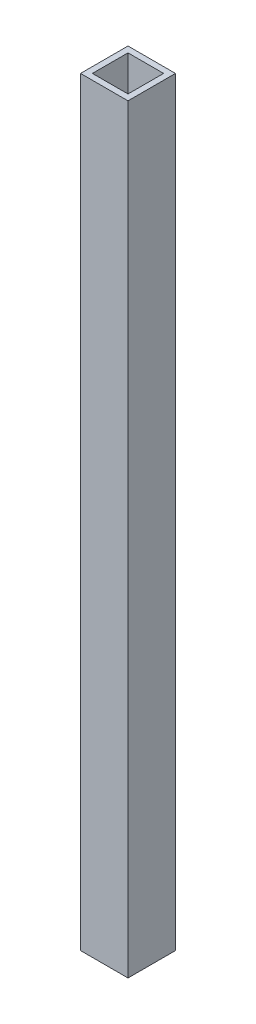
from build123d import *

# Parameters (mm, degrees)
SKETCH1_W           = 25.4
SKETCH1_H           = 406.4
BOSS_EXTRUDE1_DEPTH = 12.7
SKETCH2_W           = 19.05
SKETCH2_H           = 19.05
CUT_EXTRUDE1_DEPTH  = 407.816144915


with BuildPart() as part:
    # Sketch1 → Boss-Extrude1 (new, symmetric)
    with BuildSketch(Plane.XY):
        with Locations((0.608860336, -9.741765373)):
            Rectangle(SKETCH1_W, SKETCH1_H)
    extrude(amount=BOSS_EXTRUDE1_DEPTH, both=True)

    # Sketch2 → Cut-Extrude1 (cut, through all)
    with BuildSketch(Plane.XZ.offset(212.941765373)):
        with Locations((0.608860336, 0)):
            Rectangle(SKETCH2_W, SKETCH2_H)
    extrude(amount=-CUT_EXTRUDE1_DEPTH, mode=Mode.SUBTRACT)


solid = part.part
